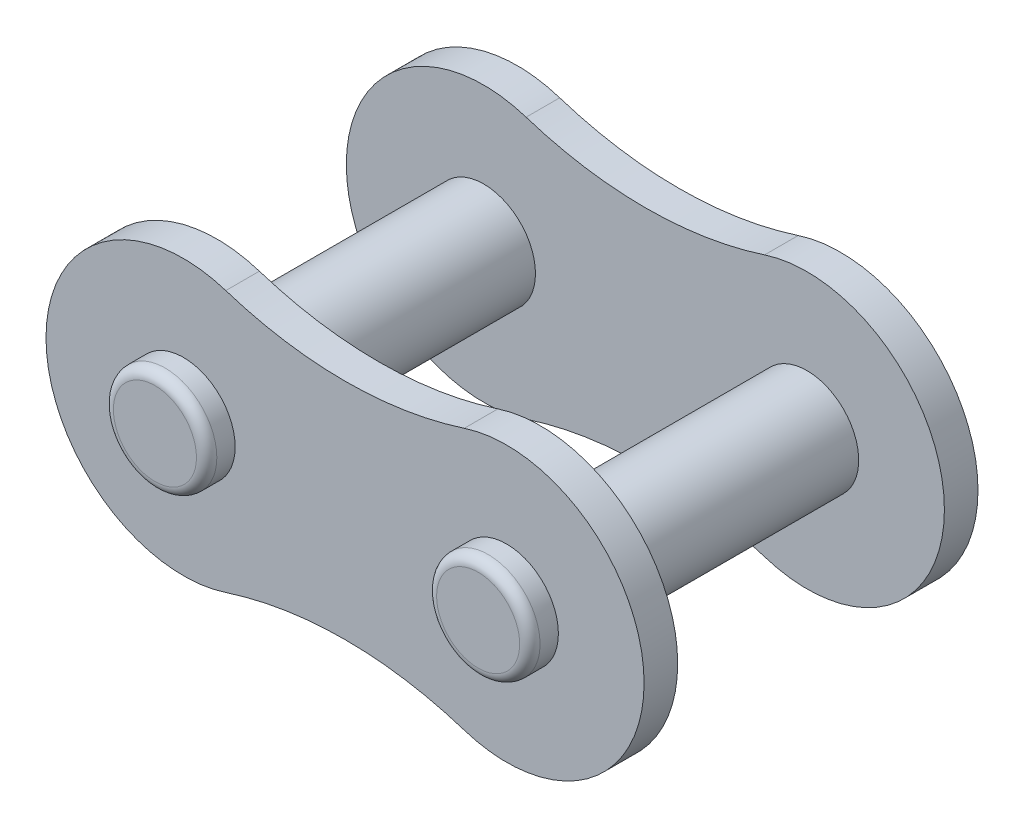
from build123d import *

# Parameters (mm, degrees)
SKETCH3_R           = 2.54
BOSS_EXTRUDE1_DEPTH = 1.65


with BuildPart() as part:
    # Sketch1 → Revolve1 (revolve)
    with BuildSketch(Plane(origin=(0, 0, 0), x_dir=(1, 0, 0), z_dir=(0, 1, 0))):
        with BuildLine():
            Line((0, -9.6), (0, 9.6))
            Line((0, 9.6), (2.04, 9.6))
            ThreePointArc((2.04, 9.6), (2.393553391, 9.453553391), (2.54, 9.1))
            Line((2.54, 9.1), (2.54, -9.1))
            ThreePointArc((2.54, -9.1), (2.393553391, -9.453553391), (2.04, -9.6))
            Line((2.04, -9.6), (0, -9.6))
        make_face()
    revolve(axis=Axis((0, 0, -10.56), (0, 0, 1)))



with BuildPart() as body_2:
    # Sketch2 → Revolve2 (revolve)
    with BuildSketch(Plane.XZ):
        with BuildLine():
            Line((-15.875, 9.6), (-17.915, 9.6))
            ThreePointArc((-17.915, 9.6), (-18.268553391, 9.453553391), (-18.415, 9.1))
            Line((-18.415, 9.1), (-18.415, -9.1))
            ThreePointArc((-18.415, -9.1), (-18.268553391, -9.453553391), (-17.915, -9.6))
            Line((-17.915, -9.6), (-15.875, -9.6))
            Line((-15.875, -9.6), (-15.875, 9.6))
        make_face()
    revolve(axis=Axis((-15.875, 0, 9.6), (0, 0, -1)))


with BuildPart() as part_1:
    add(part.part)

    add(body_2.part)  # Boss-Extrude1 merges body 2
    # Sketch3 → Boss-Extrude1 (add)
    with BuildSketch(Plane(origin=(0, 0, -6.55), x_dir=(0, -1, 0), z_dir=(0, 0, -1))):
        with BuildLine():
            ThreePointArc((-6.421306047, 2.080703883), (0, -6.75), (6.421306047, 2.080703883))
            ThreePointArc((6.421306047, 2.080703883), (5.496093439, 7.9375), (6.421306047, 13.794296117))
            ThreePointArc((6.421306047, 13.794296117), (0, 22.625), (-6.421306047, 13.794296117))
            ThreePointArc((-6.421306047, 13.794296117), (-5.496093439, 7.9375), (-6.421306047, 2.080703883))
        make_face()
        Circle(SKETCH3_R, mode=Mode.SUBTRACT)
        with Locations((0, 15.875)):
            Circle(SKETCH3_R, mode=Mode.SUBTRACT)
    boss_extrude1 = extrude(amount=BOSS_EXTRUDE1_DEPTH)

    # Mirror1: Boss-Extrude1 across plane
    add(boss_extrude1.mirror(Plane.XY))


solid = part_1.part
